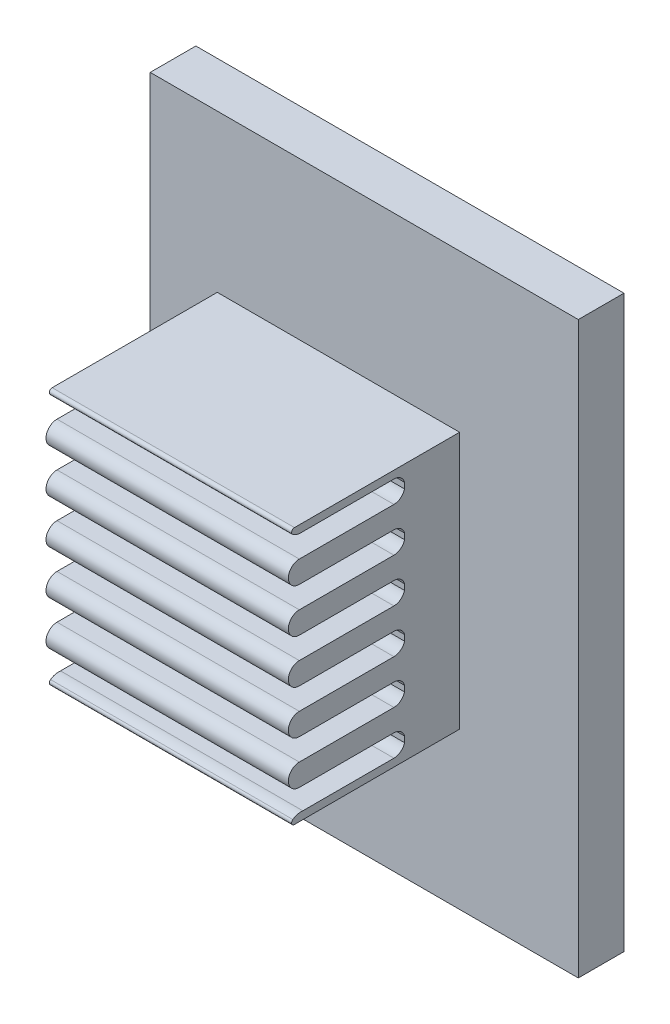
from build123d import *

# Parameters (mm, degrees)
CROQUIS1_W              = 15
CROQUIS1_H              = 19.98
SALIENTE_EXTRUIR1_DEPTH = 1.6
CROQUIS2_W              = 8.49
CROQUIS2_H              = 9.01
SALIENTE_EXTRUIR2_DEPTH = 6
CORTAR_EXTRUIR1_DEPTH   = 18.820847342
REDONDEO1_R             = 0.1
REDONDEO2_R             = 0.1


with BuildPart() as part:
    # Croquis1 → Saliente-Extruir1 (new body)
    with BuildSketch(Plane.XY):
        Rectangle(CROQUIS1_W, CROQUIS1_H)
    extrude(amount=SALIENTE_EXTRUIR1_DEPTH)

    # Croquis2 → Saliente-Extruir2 (add)
    with BuildSketch(Plane.XY.offset(1.6)):
        with Locations((-0.905, -0.015)):
            Rectangle(CROQUIS2_W, CROQUIS2_H)
    extrude(amount=SALIENTE_EXTRUIR2_DEPTH)

    # Croquis3 → Cortar-Extruir1 (cut, through all)
    with BuildSketch(Plane.ZY.offset(5.15)):
        with BuildLine():
            ThreePointArc((7.215, 3.45), (7.487236111, 3.337236111), (7.6, 3.065))
            Line((7.6, 3.065), (7.6, 4.49))
            ThreePointArc((7.6, 4.49), (7.441092235, 4.307099962), (7.215, 4.22))
            ThreePointArc((7.215, 4.22), (7.153028067, 4.216157783), (7.091056134, 4.22))
            Line((7.091056134, 4.22), (3.9, 4.22))
            ThreePointArc((3.9, 4.22), (3.6659049, 4.14065419), (3.528300528, 3.935321996))
            Line((3.528300528, 3.935321996), (3.528300528, 3.734678004))
            ThreePointArc((3.528300528, 3.734678004), (3.6659049, 3.52934581), (3.9, 3.45))
            Line((3.9, 3.45), (7.215, 3.45))
        make_face()
        with BuildLine():
            ThreePointArc((7.215, 1.91), (7.487236111, 1.797236111), (7.6, 1.525))
            Line((7.6, 1.525), (7.6, 3.065))
            ThreePointArc((7.6, 3.065), (7.487236111, 2.792763889), (7.215, 2.68))
            Line((7.215, 2.68), (3.9, 2.68))
            ThreePointArc((3.9, 2.68), (3.6659049, 2.60065419), (3.528300528, 2.395321996))
            Line((3.528300528, 2.395321996), (3.528300528, 2.194678004))
            ThreePointArc((3.528300528, 2.194678004), (3.6659049, 1.98934581), (3.9, 1.91))
            Line((3.9, 1.91), (7.215, 1.91))
        make_face()
        with BuildLine():
            Line((3.9, 0.37), (7.215, 0.37))
            ThreePointArc((7.215, 0.37), (7.487236111, 0.257236111), (7.6, -0.015))
            Line((7.6, -0.015), (7.6, 1.525))
            ThreePointArc((7.6, 1.525), (7.487236111, 1.252763889), (7.215, 1.14))
            Line((7.215, 1.14), (3.9, 1.14))
            ThreePointArc((3.9, 1.14), (3.6659049, 1.06065419), (3.528300528, 0.855321996))
            Line((3.528300528, 0.855321996), (3.528300528, 0.654678004))
            ThreePointArc((3.528300528, 0.654678004), (3.6659049, 0.44934581), (3.9, 0.37))
        make_face()
        with BuildLine():
            Line((7.6, -1.555), (7.6, -0.015))
            ThreePointArc((7.6, -0.015), (7.487236111, -0.287236111), (7.215, -0.4))
            Line((7.215, -0.4), (3.9, -0.4))
            ThreePointArc((3.9, -0.4), (3.6659049, -0.47934581), (3.528300528, -0.684678004))
            Line((3.528300528, -0.684678004), (3.528300528, -0.885321996))
            ThreePointArc((3.528300528, -0.885321996), (3.6659049, -1.09065419), (3.9, -1.17))
            Line((3.9, -1.17), (7.215, -1.17))
            ThreePointArc((7.215, -1.17), (7.487236111, -1.282763889), (7.6, -1.555))
        make_face()
        with BuildLine():
            Line((7.6, -3.095), (7.6, -1.555))
            ThreePointArc((7.6, -1.555), (7.487236111, -1.827236111), (7.215, -1.94))
            Line((7.215, -1.94), (3.9, -1.94))
            ThreePointArc((3.9, -1.94), (3.6659049, -2.01934581), (3.528300528, -2.224678004))
            Line((3.528300528, -2.224678004), (3.528300528, -2.425321996))
            ThreePointArc((3.528300528, -2.425321996), (3.6659049, -2.63065419), (3.9, -2.71))
            Line((3.9, -2.71), (7.215, -2.71))
            ThreePointArc((7.215, -2.71), (7.487236111, -2.822763889), (7.6, -3.095))
        make_face()
        with BuildLine():
            Line((7.6, -4.52), (7.6, -3.095))
            ThreePointArc((7.6, -3.095), (7.487236111, -3.367236111), (7.215, -3.48))
            Line((7.215, -3.48), (3.9, -3.48))
            ThreePointArc((3.9, -3.48), (3.6659049, -3.55934581), (3.528300528, -3.764678004))
            Line((3.528300528, -3.764678004), (3.528300528, -3.965321996))
            ThreePointArc((3.528300528, -3.965321996), (3.6659049, -4.17065419), (3.9, -4.25))
            Line((3.9, -4.25), (7.091056134, -4.25))
            ThreePointArc((7.091056134, -4.25), (7.153028067, -4.246157783), (7.215, -4.25))
            ThreePointArc((7.215, -4.25), (7.441092235, -4.337099962), (7.6, -4.52))
        make_face()
    extrude(amount=-CORTAR_EXTRUIR1_DEPTH, mode=Mode.SUBTRACT)

    # Redondeo1
    redondeo1_edges = [part.edges().sort_by_distance(p)[0] for p in [
        (-0.905, -4.52, 7.6),
    ]]
    fillet(redondeo1_edges, radius=REDONDEO1_R)

    # Redondeo2
    redondeo2_edges = [part.edges().sort_by_distance(p)[0] for p in [
        (-0.905, 4.49, 7.6),
    ]]
    fillet(redondeo2_edges, radius=REDONDEO2_R)


solid = part.part
